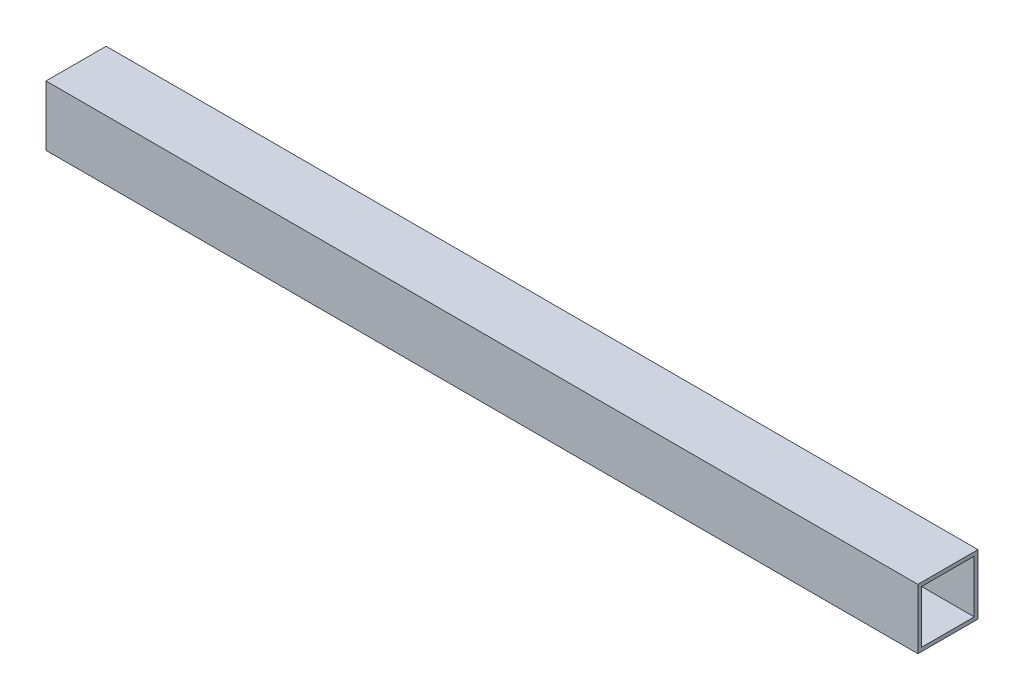
from build123d import *

# Parameters (mm, degrees)
SKETCH1_W           = 25.4
SKETCH1_H           = 25.4
SKETCH1_W_2         = 22.225
SKETCH1_H_2         = 22.225
BOSS_EXTRUDE1_DEPTH = 368.3


with BuildPart() as part:
    # Sketch1 → Boss-Extrude1 (new body)
    with BuildSketch(Plane(origin=(0, 0, 0), x_dir=(0, 0, -1), z_dir=(1, 0, 0))):
        Rectangle(SKETCH1_W, SKETCH1_H)
        Rectangle(SKETCH1_W_2, SKETCH1_H_2, mode=Mode.SUBTRACT)
    extrude(amount=BOSS_EXTRUDE1_DEPTH)


solid = part.part
